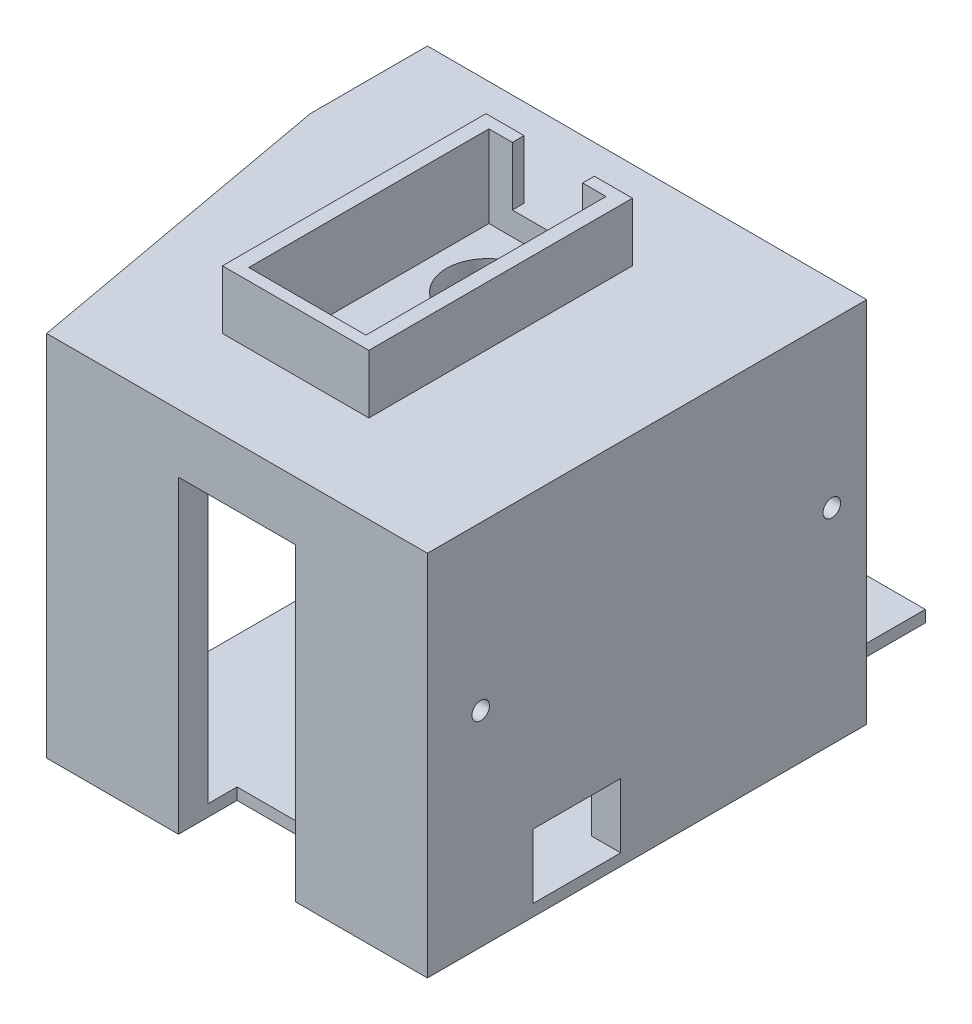
from build123d import *

# Parameters (mm, degrees)
SKETCH1_W                  = 55
SKETCH1_H                  = 65
BASE_DEPTH                 = 2
SKETCH2_R                  = 1.2
PIMOUNTSCREWHOLES_DEPTH    = 2
SKETCH3_W                  = 20
SKETCH3_H                  = 2
PLATELEGEXT_1_DEPTH        = 10
SKETCH19_W                 = 55
SKETCH19_H                 = 2
PIFRONTBASE_DEPTH          = 20
SKETCH21_W                 = 65
SKETCH21_H                 = 2
BATTERYWALL_EXT_DEPTH      = 10
SKETCH22_W                 = 22.5
SKETCH22_H                 = 2
SKETCH22_W_2               = 12.5
PLATELEGEXT_2_DEPTH        = 10
SKETCH30_W                 = 10
SKETCH30_H                 = 2
CORNEREXTENSION_DEPTH      = 10
SKETCH23_W                 = 22.5
SKETCH23_H                 = 5
SKETCH23_W_2               = 5
SKETCH23_H_2               = 20
PLATELEGS_DEPTH            = 50.8
SKETCH29_R                 = 1.5
BATTERY_SCREWHOLES_DEPTH   = 5
ROTATORPLATE_DEPTH         = 10
SKETCH25_W                 = 20
SKETCH25_H                 = 41
INSET_SERVO_DEPTH          = 4
SKETCH26_R                 = 1.5
HOLE_SERVOSCREW_DEPTH      = 6
SKETCH27_R                 = 7
INSET_SERVOAXLE_DEPTH      = 5.8
RETAININGWALLS_SERVO_DEPTH = 10
SKETCH31_W                 = 15
SKETCH31_H                 = 11
POWER_HOLE_DEPTH           = 5


with BuildPart() as part:
    # Sketch1 → Base (new body)
    with BuildSketch(Plane(origin=(0, 0, 0), x_dir=(1, 0, 0), z_dir=(0, 1, 0))):
        with Locations((27.5, 32.5)):
            Rectangle(SKETCH1_W, SKETCH1_H)
    extrude(amount=BASE_DEPTH)

    # Sketch2 → PiMountScrewHoles (cut)
    with BuildSketch(Plane(origin=(0, 2, 0), x_dir=(1, 0, 0), z_dir=(0, 1, 0))):
        with Locations(Location((3, 3.5, 0), (0, 0, 270))):
            Circle(SKETCH2_R)
        with Locations(Location((52, 3.5, 0), (0, 0, 270))):
            Circle(SKETCH2_R)
        with Locations(Location((3, 61.5, 0), (0, 0, 270))):
            Circle(SKETCH2_R)
        with Locations(Location((52, 61.5, 0), (0, 0, 270))):
            Circle(SKETCH2_R)
    extrude(amount=-PIMOUNTSCREWHOLES_DEPTH, mode=Mode.SUBTRACT)

    # Sketch3 → PlateLegExt-1 (add)
    with BuildSketch(Plane.ZY):
        with Locations((-55, 1)):
            Rectangle(SKETCH3_W, SKETCH3_H)
    extrude(amount=PLATELEGEXT_1_DEPTH)

    # Sketch19 → PiFrontBase (add)
    with BuildSketch(Plane(origin=(0, 0, -65), x_dir=(-1, 0, 0), z_dir=(0, 0, -1))):
        with Locations((-27.5, 1)):
            Rectangle(SKETCH19_W, SKETCH19_H)
    extrude(amount=PIFRONTBASE_DEPTH)

    # Sketch21 → BatteryWall-Ext (add)
    with BuildSketch(Plane(origin=(55, 0, 0), x_dir=(0, 0, -1), z_dir=(1, 0, 0))):
        with Locations((32.5, 1)):
            Rectangle(SKETCH21_W, SKETCH21_H)
    extrude(amount=BATTERYWALL_EXT_DEPTH)

    # Sketch22 → PlateLegExt-2 (add)
    with BuildSketch(Plane.XY):
        with Locations((11.25, 1)):
            Rectangle(SKETCH22_W, SKETCH22_H)
        with Locations((48.75, 1)):
            Rectangle(SKETCH22_W_2, SKETCH22_H)
    extrude(amount=PLATELEGEXT_2_DEPTH)

    # Sketch30 → CornerExtension (add)
    with BuildSketch(Plane(origin=(55, 0, 0), x_dir=(0, 0, -1), z_dir=(1, 0, 0))):
        with Locations((-5, 1)):
            Rectangle(SKETCH30_W, SKETCH30_H)
    extrude(amount=CORNEREXTENSION_DEPTH)

    # Sketch23 → PlateLegs (add)
    with BuildSketch(Plane(origin=(0, 2, 0), x_dir=(1, 0, 0), z_dir=(0, 1, 0))):
        with Locations((11.25, -7.5)):
            Rectangle(SKETCH23_W, SKETCH23_H)
        with Locations((-7.5, 55)):
            Rectangle(SKETCH23_W_2, SKETCH23_H_2)
        Polygon((60, 65), (65, 65), (65, -10), (42.5, -10), (42.5, -5), (60, -5), align=None)
    extrude(amount=PLATELEGS_DEPTH)

    # Sketch29 → Battery-ScrewHoles (cut)
    with BuildSketch(Plane(origin=(65, 0, 0), x_dir=(0, 0, -1), z_dir=(1, 0, 0))):
        with Locations((59.045, 35)):
            Circle(SKETCH29_R)
        with Locations((-0.905, 35)):
            Circle(SKETCH29_R)
    extrude(amount=-BATTERY_SCREWHOLES_DEPTH, mode=Mode.SUBTRACT)

    # Sketch24 → RotatorPlate (add)
    with BuildSketch(Plane(origin=(0, 52.8, 0), x_dir=(1, 0, 0), z_dir=(0, 1, 0))):
        Polygon((0, -10), (65, -10), (65, 65), (-10, 65), (-10, 45), align=None)
    extrude(amount=ROTATORPLATE_DEPTH)

    # Sketch25 → Inset-Servo (cut)
    with BuildSketch(Plane(origin=(0, 62.8, 0), x_dir=(1, 0, 0), z_dir=(0, 1, 0))):
        with Locations((27.5, 27.5)):
            Rectangle(SKETCH25_W, SKETCH25_H)
    extrude(amount=-INSET_SERVO_DEPTH, mode=Mode.SUBTRACT)

    # Sketch26 → Hole-ServoScrew (cut)
    with BuildSketch(Plane(origin=(0, 58.8, 0), x_dir=(1, 0, 0), z_dir=(0, 1, 0))):
        with Locations(Location((27.5, 37.75, 0), (0, 0, 270))):
            Circle(SKETCH26_R)
    extrude(amount=-HOLE_SERVOSCREW_DEPTH, mode=Mode.SUBTRACT)

    # Sketch27 → Inset-ServoAxle (cut)
    with BuildSketch(Plane(origin=(0, 58.8, 0), x_dir=(1, 0, 0), z_dir=(0, 1, 0))):
        with Locations(Location((27.5, 37.75, 0), (0, 0, 270))):
            Circle(SKETCH27_R)
    extrude(amount=-INSET_SERVOAXLE_DEPTH, mode=Mode.SUBTRACT)

    # Sketch28 → RetainingWalls-Servo (add)
    with BuildSketch(Plane(origin=(0, 62.8, 0), x_dir=(1, 0, 0), z_dir=(0, 1, 0))):
        Polygon((37.5, 48), (33.5, 48), (33.5, 50), (40, 50), (40, 5), (15, 5), (15, 50), (21.5, 50), (21.5, 48), (17.5, 48), (17.5, 7), (37.5, 7), align=None)
    extrude(amount=RETAININGWALLS_SERVO_DEPTH)

    # Sketch31 → Power-Hole (cut)
    with BuildSketch(Plane.ZY.offset(-60)):
        with Locations((-15.5, 7.5)):
            Rectangle(SKETCH31_W, SKETCH31_H)
    extrude(amount=-POWER_HOLE_DEPTH, mode=Mode.SUBTRACT)


solid = part.part
